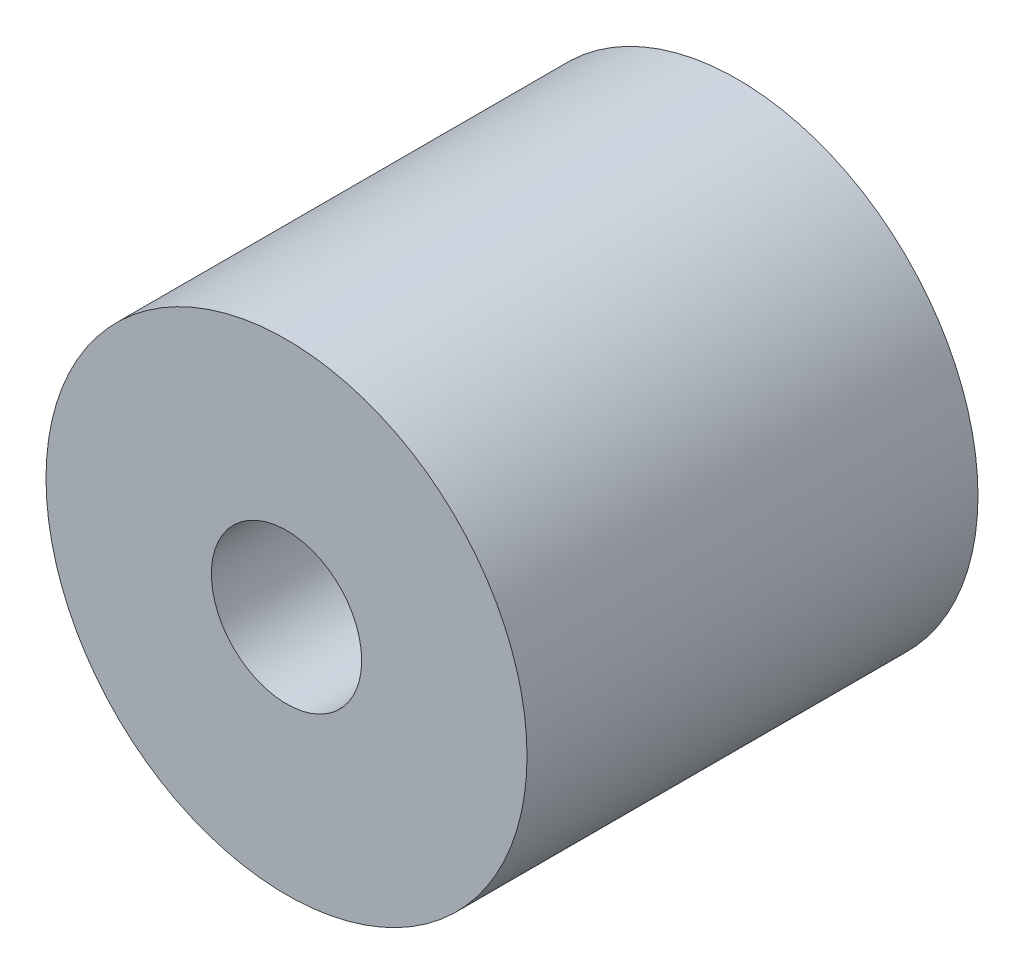
from build123d import *

# Parameters (mm, degrees)
SKETCH_1_R              = 8
SKETCH_1_R_2            = 2.5
FOOT_M6_TAPPED_15_DEPTH = 15


with BuildPart() as part:
    # 草图1 → Foot_M6_tapped_15 (new body)
    with BuildSketch(Plane.XY):
        Circle(SKETCH_1_R)
        Circle(SKETCH_1_R_2, mode=Mode.SUBTRACT)
    extrude(amount=FOOT_M6_TAPPED_15_DEPTH)


solid = part.part
